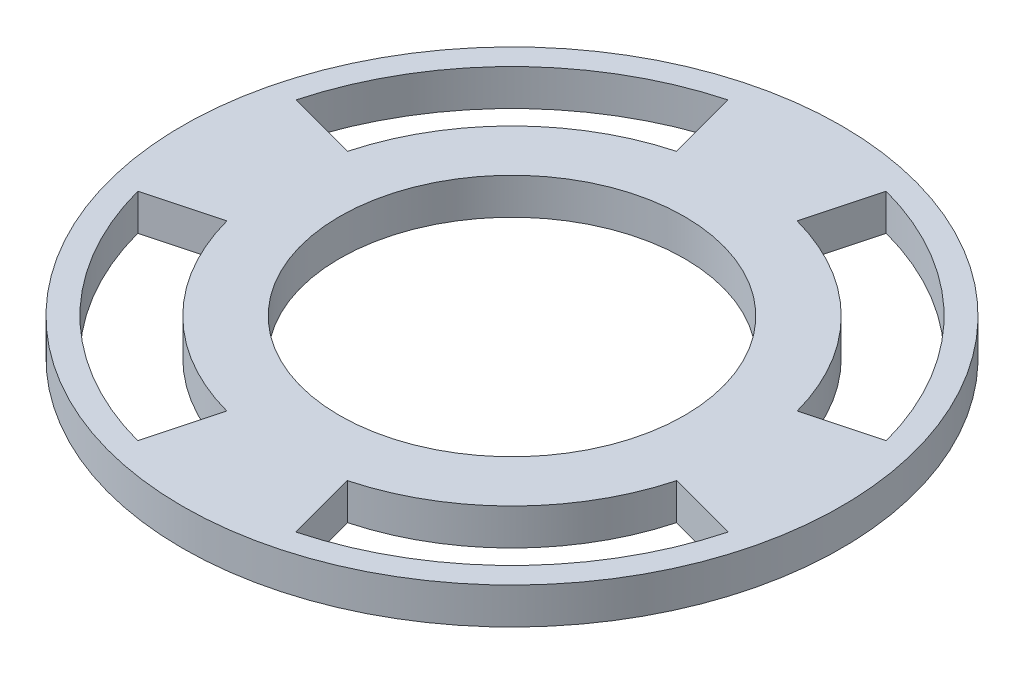
from build123d import *

# Parameters (mm, degrees)
BOSS_EXTRUDE2_DEPTH = 2.5


with BuildPart() as part:
    # Sketch1 → Boss-Extrude2 (new body)
    with BuildSketch(Plane(origin=(0, 0, 0), x_dir=(1, 0, 0), z_dir=(0, 1, 0))):
        with BuildLine():
            ThreePointArc((-20.284442352, 5.435199947), (-14.849242405, 14.849242405), (-5.435199947, 20.284442352))
            Line((-5.435199947, 20.284442352), (-5.862251372, 21.878219965))
            ThreePointArc((-5.862251372, 21.878219965), (-16.015968594, 16.015968594), (-21.878219965, 5.862251372))
            Line((-21.878219965, 5.862251372), (-20.284442352, 5.435199947))
        make_face()
        with BuildLine():
            ThreePointArc((-20.284442352, -5.435199947), (-21, 0), (-20.284442352, 5.435199947))
            Line((-20.284442352, 5.435199947), (-21.878219965, 5.862251372))
            ThreePointArc((-21.878219965, 5.862251372), (-22.65, 0), (-21.878219965, -5.862251372))
            Line((-21.878219965, -5.862251372), (-20.284442352, -5.435199947))
        make_face()
        with BuildLine():
            Line((-5.862251372, -21.878219965), (-5.435199947, -20.284442352))
            ThreePointArc((-5.435199947, -20.284442352), (-14.849242405, -14.849242405), (-20.284442352, -5.435199947))
            Line((-20.284442352, -5.435199947), (-21.878219965, -5.862251372))
            ThreePointArc((-21.878219965, -5.862251372), (-16.015968594, -16.015968594), (-5.862251372, -21.878219965))
        make_face()
        with BuildLine():
            ThreePointArc((5.435199947, -20.284442352), (0, -21), (-5.435199947, -20.284442352))
            Line((-5.435199947, -20.284442352), (-5.862251372, -21.878219965))
            ThreePointArc((-5.862251372, -21.878219965), (0, -22.65), (5.862251372, -21.878219965))
            Line((5.862251372, -21.878219965), (5.435199947, -20.284442352))
        make_face()
        with BuildLine():
            Line((21.878219965, -5.862251372), (20.284442352, -5.435199947))
            ThreePointArc((20.284442352, -5.435199947), (14.849242405, -14.849242405), (5.435199947, -20.284442352))
            Line((5.435199947, -20.284442352), (5.862251372, -21.878219965))
            ThreePointArc((5.862251372, -21.878219965), (16.015968594, -16.015968594), (21.878219965, -5.862251372))
        make_face()
        with BuildLine():
            ThreePointArc((21, 0), (20.820342089, -2.741050037), (20.284442352, -5.435199947))
            Line((20.284442352, -5.435199947), (21.878219965, -5.862251372))
            ThreePointArc((21.878219965, -5.862251372), (22.45622611, -2.956418254), (22.65, 0))
            ThreePointArc((22.65, 0), (22.45622611, 2.956418254), (21.878219965, 5.862251372))
            Line((21.878219965, 5.862251372), (20.284442352, 5.435199947))
            ThreePointArc((20.284442352, 5.435199947), (20.820342089, 2.741050037), (21, 0))
        make_face()
        with BuildLine():
            Line((5.862251372, 21.878219965), (5.435199947, 20.284442352))
            ThreePointArc((5.435199947, 20.284442352), (14.849242405, 14.849242405), (20.284442352, 5.435199947))
            Line((20.284442352, 5.435199947), (21.878219965, 5.862251372))
            ThreePointArc((21.878219965, 5.862251372), (16.015968594, 16.015968594), (5.862251372, 21.878219965))
        make_face()
        with BuildLine():
            Line((0, 22.65), (0, 21))
            ThreePointArc((0, 21), (2.741050037, 20.820342089), (5.435199947, 20.284442352))
            Line((5.435199947, 20.284442352), (5.862251372, 21.878219965))
            ThreePointArc((5.862251372, 21.878219965), (2.956418254, 22.45622611), (0, 22.65))
        make_face()
        with BuildLine():
            ThreePointArc((-5.435199947, 20.284442352), (-2.741050037, 20.820342089), (0, 21))
            Line((0, 21), (0, 22.65))
            ThreePointArc((0, 22.65), (-2.956418254, 22.45622611), (-5.862251372, 21.878219965))
            Line((-5.862251372, 21.878219965), (-5.435199947, 20.284442352))
        make_face()
        with BuildLine():
            ThreePointArc((-11.446221042, 3.067005684), (-8.379215357, 8.379215357), (-3.067005684, 11.446221042))
            Line((-3.067005684, 11.446221042), (-4.141104722, 15.454813221))
            ThreePointArc((-4.141104722, 15.454813221), (-11.313708499, 11.313708499), (-15.454813221, 4.141104722))
            Line((-15.454813221, 4.141104722), (-11.446221042, 3.067005684))
        make_face()
        with BuildLine():
            ThreePointArc((-11.446221042, -3.067005684), (-11.85, 0), (-11.446221042, 3.067005684))
            Line((-11.446221042, 3.067005684), (-15.454813221, 4.141104722))
            ThreePointArc((-15.454813221, 4.141104722), (-16, 0), (-15.454813221, -4.141104722))
            Line((-15.454813221, -4.141104722), (-11.446221042, -3.067005684))
        make_face()
        with BuildLine():
            ThreePointArc((3.067005684, -11.446221042), (0, -11.85), (-3.067005684, -11.446221042))
            Line((-3.067005684, -11.446221042), (-4.141104722, -15.454813221))
            ThreePointArc((-4.141104722, -15.454813221), (0, -16), (4.141104722, -15.454813221))
            Line((4.141104722, -15.454813221), (3.067005684, -11.446221042))
        make_face()
        with BuildLine():
            Line((15.454813221, -4.141104722), (11.446221042, -3.067005684))
            ThreePointArc((11.446221042, -3.067005684), (8.379215357, -8.379215357), (3.067005684, -11.446221042))
            Line((3.067005684, -11.446221042), (4.141104722, -15.454813221))
            ThreePointArc((4.141104722, -15.454813221), (11.313708499, -11.313708499), (15.454813221, -4.141104722))
        make_face()
        with BuildLine():
            ThreePointArc((16, 0), (15.863117782, -2.088419076), (15.454813221, -4.141104722))
            Line((15.454813221, -4.141104722), (20.284442352, -5.435199947))
            ThreePointArc((20.284442352, -5.435199947), (20.820342089, -2.741050037), (21, 0))
            ThreePointArc((21, 0), (20.820342089, 2.741050037), (20.284442352, 5.435199947))
            Line((20.284442352, 5.435199947), (15.454813221, 4.141104722))
            ThreePointArc((15.454813221, 4.141104722), (15.863117782, 2.088419076), (16, 0))
        make_face()
        with BuildLine():
            ThreePointArc((11.85, 0), (11.748621607, -1.546735378), (11.446221042, -3.067005684))
            Line((11.446221042, -3.067005684), (15.454813221, -4.141104722))
            ThreePointArc((15.454813221, -4.141104722), (15.863117782, -2.088419076), (16, 0))
            ThreePointArc((16, 0), (15.863117782, 2.088419076), (15.454813221, 4.141104722))
            Line((15.454813221, 4.141104722), (11.446221042, 3.067005684))
            ThreePointArc((11.446221042, 3.067005684), (11.748621607, 1.546735378), (11.85, 0))
        make_face()
        with BuildLine():
            Line((0, 21), (0, 16))
            ThreePointArc((0, 16), (2.088419076, 15.863117782), (4.141104722, 15.454813221))
            Line((4.141104722, 15.454813221), (5.435199947, 20.284442352))
            ThreePointArc((5.435199947, 20.284442352), (2.741050037, 20.820342089), (0, 21))
        make_face()
        with BuildLine():
            ThreePointArc((-3.067005684, 11.446221042), (-1.546735378, 11.748621607), (0, 11.85))
            Line((0, 11.85), (0, 16))
            ThreePointArc((0, 16), (-2.088419076, 15.863117782), (-4.141104722, 15.454813221))
            Line((-4.141104722, 15.454813221), (-3.067005684, 11.446221042))
        make_face()
        with BuildLine():
            Line((0, 16), (0, 11.85))
            ThreePointArc((0, 11.85), (1.546735378, 11.748621607), (3.067005684, 11.446221042))
            Line((3.067005684, 11.446221042), (4.141104722, 15.454813221))
            ThreePointArc((4.141104722, 15.454813221), (2.088419076, 15.863117782), (0, 16))
        make_face()
        with BuildLine():
            Line((-4.141104722, -15.454813221), (-3.067005684, -11.446221042))
            ThreePointArc((-3.067005684, -11.446221042), (-8.379215357, -8.379215357), (-11.446221042, -3.067005684))
            Line((-11.446221042, -3.067005684), (-15.454813221, -4.141104722))
            ThreePointArc((-15.454813221, -4.141104722), (-11.313708499, -11.313708499), (-4.141104722, -15.454813221))
        make_face()
        with BuildLine():
            ThreePointArc((4.141104722, -15.454813221), (0, -16), (-4.141104722, -15.454813221))
            Line((-4.141104722, -15.454813221), (-5.435199947, -20.284442352))
            ThreePointArc((-5.435199947, -20.284442352), (0, -21), (5.435199947, -20.284442352))
            Line((5.435199947, -20.284442352), (4.141104722, -15.454813221))
        make_face()
        with BuildLine():
            ThreePointArc((-4.141104722, 15.454813221), (-2.088419076, 15.863117782), (0, 16))
            Line((0, 16), (0, 21))
            ThreePointArc((0, 21), (-2.741050037, 20.820342089), (-5.435199947, 20.284442352))
            Line((-5.435199947, 20.284442352), (-4.141104722, 15.454813221))
        make_face()
        with BuildLine():
            Line((4.141104722, 15.454813221), (3.067005684, 11.446221042))
            ThreePointArc((3.067005684, 11.446221042), (8.379215357, 8.379215357), (11.446221042, 3.067005684))
            Line((11.446221042, 3.067005684), (15.454813221, 4.141104722))
            ThreePointArc((15.454813221, 4.141104722), (11.313708499, 11.313708499), (4.141104722, 15.454813221))
        make_face()
        with BuildLine():
            ThreePointArc((-15.454813221, -4.141104722), (-16, 0), (-15.454813221, 4.141104722))
            Line((-15.454813221, 4.141104722), (-20.284442352, 5.435199947))
            ThreePointArc((-20.284442352, 5.435199947), (-21, 0), (-20.284442352, -5.435199947))
            Line((-20.284442352, -5.435199947), (-15.454813221, -4.141104722))
        make_face()
    extrude(amount=BOSS_EXTRUDE2_DEPTH)


solid = part.part
